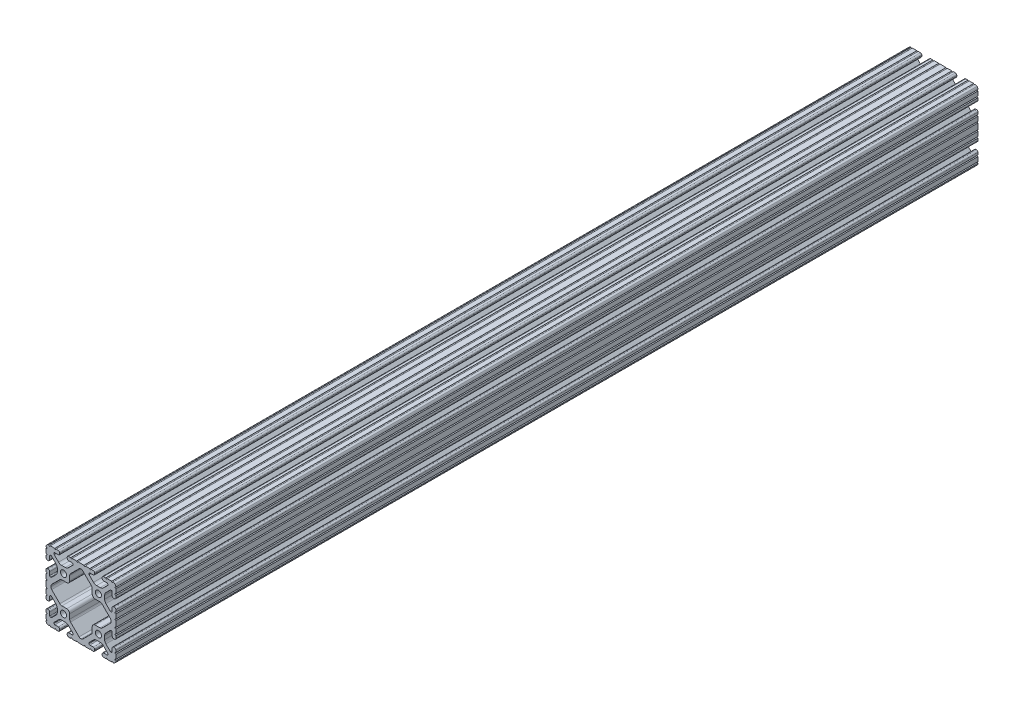
from build123d import *

# Parameters (mm, degrees)
BOSS_EXTRUDE1_DEPTH      = 469.9
BOSS_EXTRUDE1_DEPTH_BACK = 469.9
SKETCH3_R                = 3.3274


with BuildPart() as part:
    # Sketch3 → Boss-Extrude1 (new, two sides: drawn at the far end of the back side and taken through both)
    with BuildSketch(Plane.XY.offset(-BOSS_EXTRUDE1_DEPTH_BACK)):
        with BuildLine():
            Line((34.036, 28.448), (34.036, 24.630196049))
            ThreePointArc((34.036, 24.630196049), (34.497248241, 23.51664429), (35.6108, 23.055396049))
            Line((35.6108, 23.055396049), (36.525200183, 23.055396049))
            ThreePointArc((36.525200183, 23.055396049), (37.638751813, 23.516644236), (38.1, 24.630195866))
            Line((38.1, 24.630195866), (38.1, 27.023826138))
            ThreePointArc((38.1, 27.023826138), (37.117780706, 27.7845421), (38.1, 28.545258062))
            Line((38.1, 28.545258062), (38.1, 33.373016026))
            ThreePointArc((38.1, 33.373016026), (37.141472621, 34.109236774), (38.1, 34.845457521))
            ThreePointArc((38.1, 34.845457521), (37.837757813, 36.120195002), (37.086123144, 37.182631793))
            ThreePointArc((37.086123144, 37.182631793), (36.106286572, 37.843374398), (34.952681874, 38.1))
            ThreePointArc((34.952681874, 38.1), (34.190730434, 37.320215335), (33.428778994, 38.1))
            Line((33.428778994, 38.1), (28.601105935, 38.1))
            ThreePointArc((28.601105935, 38.1), (27.839158581, 37.32021942), (27.077211227, 38.1))
            Line((27.077211227, 38.1), (24.6888, 38.1))
            ThreePointArc((24.6888, 38.1), (23.575248241, 37.638751759), (23.114, 36.5252))
            Line((23.114, 36.5252), (23.114, 35.6108))
            ThreePointArc((23.114, 35.6108), (23.575248241, 34.497248241), (24.6888, 34.036))
            Line((24.6888, 34.036), (28.448, 34.036))
            ThreePointArc((28.448, 34.036), (29.076617928, 33.775617928), (29.337, 33.147))
            Line((29.337, 33.147), (29.337, 32.720693454))
            ThreePointArc((29.337, 32.720693454), (29.326675076, 32.273872751), (29.100231244, 31.888543625))
            Line((29.100231244, 31.888543625), (24.409287499, 27.197588341))
            ThreePointArc((24.409287499, 27.197588341), (22.868340045, 26.167958114), (21.050667579, 25.8064))
            Line((21.050667579, 25.8064), (17.049332421, 25.8064))
            ThreePointArc((17.049332421, 25.8064), (15.231659955, 26.167958114), (13.690712501, 27.197588341))
            Line((13.690712501, 27.197588341), (9.023381298, 31.864931024))
            ThreePointArc((9.023381298, 31.864931024), (8.830670886, 32.153343113), (8.763, 32.493548179))
            Line((8.763, 32.493548179), (8.763, 33.147))
            ThreePointArc((8.763, 33.147), (9.023382072, 33.775617928), (9.652, 34.036))
            Line((9.652, 34.036), (13.4112, 34.036))
            ThreePointArc((13.4112, 34.036), (14.524751759, 34.497248241), (14.986, 35.6108))
            Line((14.986, 35.6108), (14.986, 36.5252))
            ThreePointArc((14.986, 36.5252), (14.524751759, 37.638751759), (13.4112, 38.1))
            Line((13.4112, 38.1), (11.128867074, 38.1))
            ThreePointArc((11.128867074, 38.1), (10.367071033, 37.320370693), (9.605274992, 38.1))
            Line((9.605274992, 38.1), (4.777313069, 38.1))
            ThreePointArc((4.777313069, 38.1), (4.015517029, 37.320370693), (3.253720988, 38.1))
            Line((3.253720988, 38.1), (-3.253720988, 38.1))
            ThreePointArc((-3.253720988, 38.1), (-4.015517029, 37.320370693), (-4.777313069, 38.1))
            Line((-4.777313069, 38.1), (-9.605274992, 38.1))
            ThreePointArc((-9.605274992, 38.1), (-10.367071033, 37.320370693), (-11.128867074, 38.1))
            Line((-11.128867074, 38.1), (-13.4112, 38.1))
            ThreePointArc((-13.4112, 38.1), (-14.524751759, 37.638751759), (-14.986, 36.5252))
            Line((-14.986, 36.5252), (-14.986, 35.6108))
            ThreePointArc((-14.986, 35.6108), (-14.524751759, 34.497248241), (-13.4112, 34.036))
            Line((-13.4112, 34.036), (-9.652, 34.036))
            ThreePointArc((-9.652, 34.036), (-9.023382072, 33.775617928), (-8.763, 33.147))
            Line((-8.763, 33.147), (-8.763, 32.493548179))
            ThreePointArc((-8.763, 32.493548179), (-8.830670886, 32.153343113), (-9.023381298, 31.864931024))
            Line((-9.023381298, 31.864931024), (-13.690712501, 27.197588341))
            ThreePointArc((-13.690712501, 27.197588341), (-15.231659955, 26.167958114), (-17.049332421, 25.8064))
            Line((-17.049332421, 25.8064), (-21.050667579, 25.8064))
            ThreePointArc((-21.050667579, 25.8064), (-22.868340045, 26.167958114), (-24.409287499, 27.197588341))
            Line((-24.409287499, 27.197588341), (-29.100231244, 31.888543625))
            ThreePointArc((-29.100231244, 31.888543625), (-29.326675076, 32.273872751), (-29.337, 32.720693454))
            Line((-29.337, 32.720693454), (-29.337, 33.147))
            ThreePointArc((-29.337, 33.147), (-29.076617928, 33.775617928), (-28.448, 34.036))
            Line((-28.448, 34.036), (-24.6888, 34.036))
            ThreePointArc((-24.6888, 34.036), (-23.575248241, 34.497248241), (-23.114, 35.6108))
            Line((-23.114, 35.6108), (-23.114, 36.5252))
            ThreePointArc((-23.114, 36.5252), (-23.575248241, 37.638751759), (-24.6888, 38.1))
            Line((-24.6888, 38.1), (-27.077211227, 38.1))
            ThreePointArc((-27.077211227, 38.1), (-27.839158581, 37.32021942), (-28.601105935, 38.1))
            Line((-28.601105935, 38.1), (-33.428778994, 38.1))
            ThreePointArc((-33.428778994, 38.1), (-34.190730434, 37.320215335), (-34.952681874, 38.1))
            ThreePointArc((-34.952681874, 38.1), (-36.106286572, 37.843374398), (-37.086123144, 37.182631793))
            ThreePointArc((-37.086123144, 37.182631793), (-37.837757813, 36.120195002), (-38.1, 34.845457521))
            ThreePointArc((-38.1, 34.845457521), (-37.141472621, 34.109236774), (-38.1, 33.373016026))
            Line((-38.1, 33.373016026), (-38.1, 28.545258062))
            ThreePointArc((-38.1, 28.545258062), (-37.117780706, 27.7845421), (-38.1, 27.023826138))
            Line((-38.1, 27.023826138), (-38.1, 24.630195866))
            ThreePointArc((-38.1, 24.630195866), (-37.638751813, 23.516644236), (-36.525200183, 23.055396049))
            Line((-36.525200183, 23.055396049), (-35.6108, 23.055396049))
            ThreePointArc((-35.6108, 23.055396049), (-34.497248241, 23.51664429), (-34.036, 24.630196049))
            Line((-34.036, 24.630196049), (-34.036, 28.448))
            ThreePointArc((-34.036, 28.448), (-33.775617928, 29.076617928), (-33.147, 29.337))
            Line((-33.147, 29.337), (-32.664287242, 29.337))
            ThreePointArc((-32.664287242, 29.337), (-32.324081166, 29.269328695), (-32.03566854, 29.076617155))
            Line((-32.03566854, 29.076617155), (-27.19758008, 24.238516795))
            ThreePointArc((-27.19758008, 24.238516795), (-26.167955879, 22.697572205), (-25.8064, 20.879905136))
            Line((-25.8064, 20.879905136), (-25.8064, 17.220094864))
            ThreePointArc((-25.8064, 17.220094864), (-26.167955879, 15.402427795), (-27.19758008, 13.861483205))
            Line((-27.19758008, 13.861483205), (-31.948944541, 9.110107057))
            ThreePointArc((-31.948944541, 9.110107057), (-32.333417096, 8.853210196), (-32.786933649, 8.763))
            Line((-32.786933649, 8.763), (-33.060275787, 8.763))
            ThreePointArc((-33.060275787, 8.763), (-33.750216995, 9.048783005), (-34.036, 9.738724213))
            Line((-34.036, 9.738724213), (-34.036, 13.469803585))
            ThreePointArc((-34.036, 13.469803585), (-34.497248348, 14.583355603), (-35.610800366, 15.044603951))
            Line((-35.610800366, 15.044603951), (-36.5252, 15.044603951))
            ThreePointArc((-36.5252, 15.044603951), (-37.638751759, 14.58335571), (-38.1, 13.469803951))
            Line((-38.1, 13.469803951), (-38.1, 11.075039289))
            ThreePointArc((-38.1, 11.075039289), (-37.117000248, 10.313517272), (-38.1, 9.551995255))
            Line((-38.1, 9.551995255), (-38.1, 4.723759308))
            ThreePointArc((-38.1, 4.723759308), (-37.117000248, 3.962237292), (-38.1, 3.200715275))
            Line((-38.1, 3.200715275), (-38.1, -3.200715275))
            ThreePointArc((-38.1, -3.200715275), (-37.117000248, -3.962237292), (-38.1, -4.723759308))
            Line((-38.1, -4.723759308), (-38.1, -9.551995255))
            ThreePointArc((-38.1, -9.551995255), (-37.117000248, -10.313517272), (-38.1, -11.075039289))
            Line((-38.1, -11.075039289), (-38.1, -13.469803951))
            ThreePointArc((-38.1, -13.469803951), (-37.638751759, -14.58335571), (-36.5252, -15.044603951))
            Line((-36.5252, -15.044603951), (-35.610800366, -15.044603951))
            ThreePointArc((-35.610800366, -15.044603951), (-34.497248348, -14.583355603), (-34.036, -13.469803585))
            Line((-34.036, -13.469803585), (-34.036, -9.738724213))
            ThreePointArc((-34.036, -9.738724213), (-33.750216995, -9.048783005), (-33.060275787, -8.763))
            Line((-33.060275787, -8.763), (-32.786933649, -8.763))
            ThreePointArc((-32.786933649, -8.763), (-32.333417096, -8.853210196), (-31.948944541, -9.110107057))
            Line((-31.948944541, -9.110107057), (-27.19758008, -13.861483205))
            ThreePointArc((-27.19758008, -13.861483205), (-26.167955879, -15.402427795), (-25.8064, -17.220094864))
            Line((-25.8064, -17.220094864), (-25.8064, -20.879905136))
            ThreePointArc((-25.8064, -20.879905136), (-26.167955879, -22.697572205), (-27.19758008, -24.238516795))
            Line((-27.19758008, -24.238516795), (-32.03566854, -29.076617155))
            ThreePointArc((-32.03566854, -29.076617155), (-32.324081166, -29.269328695), (-32.664287242, -29.337))
            Line((-32.664287242, -29.337), (-33.147, -29.337))
            ThreePointArc((-33.147, -29.337), (-33.775617928, -29.076617928), (-34.036, -28.448))
            Line((-34.036, -28.448), (-34.036, -24.630196049))
            ThreePointArc((-34.036, -24.630196049), (-34.497248241, -23.51664429), (-35.6108, -23.055396049))
            Line((-35.6108, -23.055396049), (-36.525200183, -23.055396049))
            ThreePointArc((-36.525200183, -23.055396049), (-37.638751813, -23.516644236), (-38.1, -24.630195866))
            Line((-38.1, -24.630195866), (-38.1, -27.023826138))
            ThreePointArc((-38.1, -27.023826138), (-37.117780706, -27.7845421), (-38.1, -28.545258062))
            Line((-38.1, -28.545258062), (-38.1, -33.373016026))
            ThreePointArc((-38.1, -33.373016026), (-37.141472621, -34.109236774), (-38.1, -34.845457521))
            ThreePointArc((-38.1, -34.845457521), (-37.837757813, -36.120195002), (-37.086123144, -37.182631793))
            ThreePointArc((-37.086123144, -37.182631793), (-36.106286572, -37.843374398), (-34.952681874, -38.1))
            ThreePointArc((-34.952681874, -38.1), (-34.190730434, -37.320215335), (-33.428778994, -38.1))
            Line((-33.428778994, -38.1), (-28.601105935, -38.1))
            ThreePointArc((-28.601105935, -38.1), (-27.839158581, -37.32021942), (-27.077211227, -38.1))
            Line((-27.077211227, -38.1), (-24.6888, -38.1))
            ThreePointArc((-24.6888, -38.1), (-23.575248241, -37.638751759), (-23.114, -36.5252))
            Line((-23.114, -36.5252), (-23.114, -35.6108))
            ThreePointArc((-23.114, -35.6108), (-23.575248241, -34.497248241), (-24.6888, -34.036))
            Line((-24.6888, -34.036), (-28.448, -34.036))
            ThreePointArc((-28.448, -34.036), (-29.076617928, -33.775617928), (-29.337, -33.147))
            Line((-29.337, -33.147), (-29.337, -32.720693454))
            ThreePointArc((-29.337, -32.720693454), (-29.326675076, -32.273872751), (-29.100231244, -31.888543625))
            Line((-29.100231244, -31.888543625), (-24.409287499, -27.197588341))
            ThreePointArc((-24.409287499, -27.197588341), (-22.868340045, -26.167958114), (-21.050667579, -25.8064))
            Line((-21.050667579, -25.8064), (-17.049332421, -25.8064))
            ThreePointArc((-17.049332421, -25.8064), (-15.231659955, -26.167958114), (-13.690712501, -27.197588341))
            Line((-13.690712501, -27.197588341), (-9.023381298, -31.864931024))
            ThreePointArc((-9.023381298, -31.864931024), (-8.830670886, -32.153343113), (-8.763, -32.493548179))
            Line((-8.763, -32.493548179), (-8.763, -33.147))
            ThreePointArc((-8.763, -33.147), (-9.023382072, -33.775617928), (-9.652, -34.036))
            Line((-9.652, -34.036), (-13.4112, -34.036))
            ThreePointArc((-13.4112, -34.036), (-14.524751759, -34.497248241), (-14.986, -35.6108))
            Line((-14.986, -35.6108), (-14.986, -36.5252))
            ThreePointArc((-14.986, -36.5252), (-14.524751759, -37.638751759), (-13.4112, -38.1))
            Line((-13.4112, -38.1), (-11.128867074, -38.1))
            ThreePointArc((-11.128867074, -38.1), (-10.367071033, -37.320370693), (-9.605274992, -38.1))
            Line((-9.605274992, -38.1), (-4.777313069, -38.1))
            ThreePointArc((-4.777313069, -38.1), (-4.015517029, -37.320370693), (-3.253720988, -38.1))
            Line((-3.253720988, -38.1), (3.253720988, -38.1))
            ThreePointArc((3.253720988, -38.1), (4.015517029, -37.320370693), (4.777313069, -38.1))
            Line((4.777313069, -38.1), (9.605274992, -38.1))
            ThreePointArc((9.605274992, -38.1), (10.367071033, -37.320370693), (11.128867074, -38.1))
            Line((11.128867074, -38.1), (13.4112, -38.1))
            ThreePointArc((13.4112, -38.1), (14.524751759, -37.638751759), (14.986, -36.5252))
            Line((14.986, -36.5252), (14.986, -35.6108))
            ThreePointArc((14.986, -35.6108), (14.524751759, -34.497248241), (13.4112, -34.036))
            Line((13.4112, -34.036), (9.652, -34.036))
            ThreePointArc((9.652, -34.036), (9.023382072, -33.775617928), (8.763, -33.147))
            Line((8.763, -33.147), (8.763, -32.493548179))
            ThreePointArc((8.763, -32.493548179), (8.830670886, -32.153343113), (9.023381298, -31.864931024))
            Line((9.023381298, -31.864931024), (13.690712501, -27.197588341))
            ThreePointArc((13.690712501, -27.197588341), (15.231659955, -26.167958114), (17.049332421, -25.8064))
            Line((17.049332421, -25.8064), (21.050667579, -25.8064))
            ThreePointArc((21.050667579, -25.8064), (22.868340045, -26.167958114), (24.409287499, -27.197588341))
            Line((24.409287499, -27.197588341), (29.100231244, -31.888543625))
            ThreePointArc((29.100231244, -31.888543625), (29.326675076, -32.273872751), (29.337, -32.720693454))
            Line((29.337, -32.720693454), (29.337, -33.147))
            ThreePointArc((29.337, -33.147), (29.076617928, -33.775617928), (28.448, -34.036))
            Line((28.448, -34.036), (24.6888, -34.036))
            ThreePointArc((24.6888, -34.036), (23.575248241, -34.497248241), (23.114, -35.6108))
            Line((23.114, -35.6108), (23.114, -36.5252))
            ThreePointArc((23.114, -36.5252), (23.575248241, -37.638751759), (24.6888, -38.1))
            Line((24.6888, -38.1), (27.077211227, -38.1))
            ThreePointArc((27.077211227, -38.1), (27.839158581, -37.32021942), (28.601105935, -38.1))
            Line((28.601105935, -38.1), (33.428778994, -38.1))
            ThreePointArc((33.428778994, -38.1), (34.190730434, -37.320215335), (34.952681874, -38.1))
            ThreePointArc((34.952681874, -38.1), (36.106286572, -37.843374398), (37.086123144, -37.182631793))
            ThreePointArc((37.086123144, -37.182631793), (37.837757813, -36.120195002), (38.1, -34.845457521))
            ThreePointArc((38.1, -34.845457521), (37.141472621, -34.109236774), (38.1, -33.373016026))
            Line((38.1, -33.373016026), (38.1, -28.545258062))
            ThreePointArc((38.1, -28.545258062), (37.117780706, -27.7845421), (38.1, -27.023826138))
            Line((38.1, -27.023826138), (38.1, -24.630195866))
            ThreePointArc((38.1, -24.630195866), (37.638751813, -23.516644236), (36.525200183, -23.055396049))
            Line((36.525200183, -23.055396049), (35.6108, -23.055396049))
            ThreePointArc((35.6108, -23.055396049), (34.497248241, -23.51664429), (34.036, -24.630196049))
            Line((34.036, -24.630196049), (34.036, -28.448))
            ThreePointArc((34.036, -28.448), (33.775617928, -29.076617928), (33.147, -29.337))
            Line((33.147, -29.337), (32.664287242, -29.337))
            ThreePointArc((32.664287242, -29.337), (32.324081166, -29.269328695), (32.03566854, -29.076617155))
            Line((32.03566854, -29.076617155), (27.19758008, -24.238516795))
            ThreePointArc((27.19758008, -24.238516795), (26.167955879, -22.697572205), (25.8064, -20.879905136))
            Line((25.8064, -20.879905136), (25.8064, -17.220094864))
            ThreePointArc((25.8064, -17.220094864), (26.167955879, -15.402427795), (27.19758008, -13.861483205))
            Line((27.19758008, -13.861483205), (31.948944541, -9.110107057))
            ThreePointArc((31.948944541, -9.110107057), (32.333417096, -8.853210196), (32.786933649, -8.763))
            Line((32.786933649, -8.763), (33.060275787, -8.763))
            ThreePointArc((33.060275787, -8.763), (33.750216995, -9.048783005), (34.036, -9.738724213))
            Line((34.036, -9.738724213), (34.036, -13.469803585))
            ThreePointArc((34.036, -13.469803585), (34.497248348, -14.583355603), (35.610800366, -15.044603951))
            Line((35.610800366, -15.044603951), (36.5252, -15.044603951))
            ThreePointArc((36.5252, -15.044603951), (37.638751759, -14.58335571), (38.1, -13.469803951))
            Line((38.1, -13.469803951), (38.1, -11.075039289))
            ThreePointArc((38.1, -11.075039289), (37.117000248, -10.313517272), (38.1, -9.551995255))
            Line((38.1, -9.551995255), (38.1, -4.723759308))
            ThreePointArc((38.1, -4.723759308), (37.117000248, -3.962237292), (38.1, -3.200715275))
            Line((38.1, -3.200715275), (38.1, 3.200715275))
            ThreePointArc((38.1, 3.200715275), (37.117000248, 3.962237292), (38.1, 4.723759308))
            Line((38.1, 4.723759308), (38.1, 9.551995255))
            ThreePointArc((38.1, 9.551995255), (37.117000248, 10.313517272), (38.1, 11.075039289))
            Line((38.1, 11.075039289), (38.1, 13.469803951))
            ThreePointArc((38.1, 13.469803951), (37.638751759, 14.58335571), (36.5252, 15.044603951))
            Line((36.5252, 15.044603951), (35.610800366, 15.044603951))
            ThreePointArc((35.610800366, 15.044603951), (34.497248348, 14.583355603), (34.036, 13.469803585))
            Line((34.036, 13.469803585), (34.036, 9.738724213))
            ThreePointArc((34.036, 9.738724213), (33.750216995, 9.048783005), (33.060275787, 8.763))
            Line((33.060275787, 8.763), (32.786933649, 8.763))
            ThreePointArc((32.786933649, 8.763), (32.333417096, 8.853210196), (31.948944541, 9.110107057))
            Line((31.948944541, 9.110107057), (27.19758008, 13.861483205))
            ThreePointArc((27.19758008, 13.861483205), (26.167955879, 15.402427795), (25.8064, 17.220094864))
            Line((25.8064, 17.220094864), (25.8064, 20.879905136))
            ThreePointArc((25.8064, 20.879905136), (26.167955879, 22.697572205), (27.19758008, 24.238516795))
            Line((27.19758008, 24.238516795), (32.03566854, 29.076617155))
            ThreePointArc((32.03566854, 29.076617155), (32.324081166, 29.269328695), (32.664287242, 29.337))
            Line((32.664287242, 29.337), (33.147, 29.337))
            ThreePointArc((33.147, 29.337), (33.775617928, 29.076617928), (34.036, 28.448))
        make_face()
        with Locations((19.05, 19.05)):
            Circle(SKETCH3_R, mode=Mode.SUBTRACT)
        with Locations((-19.05, 19.05)):
            Circle(SKETCH3_R, mode=Mode.SUBTRACT)
        with Locations((19.05, -19.05)):
            Circle(SKETCH3_R, mode=Mode.SUBTRACT)
        with Locations((-19.05, -19.05)):
            Circle(SKETCH3_R, mode=Mode.SUBTRACT)
        with BuildLine():
            Line((-11.363666791, -22.843321003), (-2.051515952, -32.155494748))
            ThreePointArc((-2.051515952, -32.155494748), (-1.11031328, -32.786013752), (0, -33.011005091))
            ThreePointArc((0, -33.011005091), (1.11031328, -32.786013752), (2.051515952, -32.155494748))
            Line((2.051515952, -32.155494748), (11.363666791, -22.843321003))
            ThreePointArc((11.363666791, -22.843321003), (12.051918263, -21.813277828), (12.2936, -20.598259734))
            Line((12.2936, -20.598259734), (12.2936, -15.4686))
            ThreePointArc((12.2936, -15.4686), (13.22353597, -13.22353597), (15.4686, -12.2936))
            Line((15.4686, -12.2936), (20.769026744, -12.2936))
            ThreePointArc((20.769026744, -12.2936), (21.984048446, -12.051916769), (23.014093535, -11.363661269))
            Line((23.014093535, -11.363661269), (31.902125566, -2.475607377))
            ThreePointArc((31.902125566, -2.475607377), (32.607298578, -1.335259481), (32.728725173, 0))
            ThreePointArc((32.728725173, 0), (32.607298578, 1.335259481), (31.902125566, 2.475607377))
            Line((31.902125566, 2.475607377), (23.014093535, 11.363661269))
            ThreePointArc((23.014093535, 11.363661269), (21.984048446, 12.051916769), (20.769026744, 12.2936))
            Line((20.769026744, 12.2936), (15.4686, 12.2936))
            ThreePointArc((15.4686, 12.2936), (13.22353597, 13.22353597), (12.2936, 15.4686))
            Line((12.2936, 15.4686), (12.2936, 20.598259734))
            ThreePointArc((12.2936, 20.598259734), (12.051918263, 21.813277828), (11.363666791, 22.843321003))
            Line((11.363666791, 22.843321003), (2.051515952, 32.155494748))
            ThreePointArc((2.051515952, 32.155494748), (1.11031328, 32.786013752), (0, 33.011005091))
            ThreePointArc((0, 33.011005091), (-1.11031328, 32.786013752), (-2.051515952, 32.155494748))
            Line((-2.051515952, 32.155494748), (-11.363666791, 22.843321003))
            ThreePointArc((-11.363666791, 22.843321003), (-12.051918263, 21.813277828), (-12.2936, 20.598259734))
            Line((-12.2936, 20.598259734), (-12.2936, 15.4686))
            ThreePointArc((-12.2936, 15.4686), (-13.22353597, 13.22353597), (-15.4686, 12.2936))
            Line((-15.4686, 12.2936), (-20.769026744, 12.2936))
            ThreePointArc((-20.769026744, 12.2936), (-21.984048446, 12.051916769), (-23.014093535, 11.363661269))
            Line((-23.014093535, 11.363661269), (-31.902125566, 2.475607377))
            ThreePointArc((-31.902125566, 2.475607377), (-32.607298578, 1.335259481), (-32.728725173, 0))
            ThreePointArc((-32.728725173, 0), (-32.607298578, -1.335259481), (-31.902125566, -2.475607377))
            Line((-31.902125566, -2.475607377), (-23.014093535, -11.363661269))
            ThreePointArc((-23.014093535, -11.363661269), (-21.984048446, -12.051916769), (-20.769026744, -12.2936))
            Line((-20.769026744, -12.2936), (-15.4686, -12.2936))
            ThreePointArc((-15.4686, -12.2936), (-13.22353597, -13.22353597), (-12.2936, -15.4686))
            Line((-12.2936, -15.4686), (-12.2936, -20.598259734))
            ThreePointArc((-12.2936, -20.598259734), (-12.051918263, -21.813277828), (-11.363666791, -22.843321003))
        make_face(mode=Mode.SUBTRACT)
    extrude(amount=BOSS_EXTRUDE1_DEPTH + BOSS_EXTRUDE1_DEPTH_BACK)


solid = part.part
